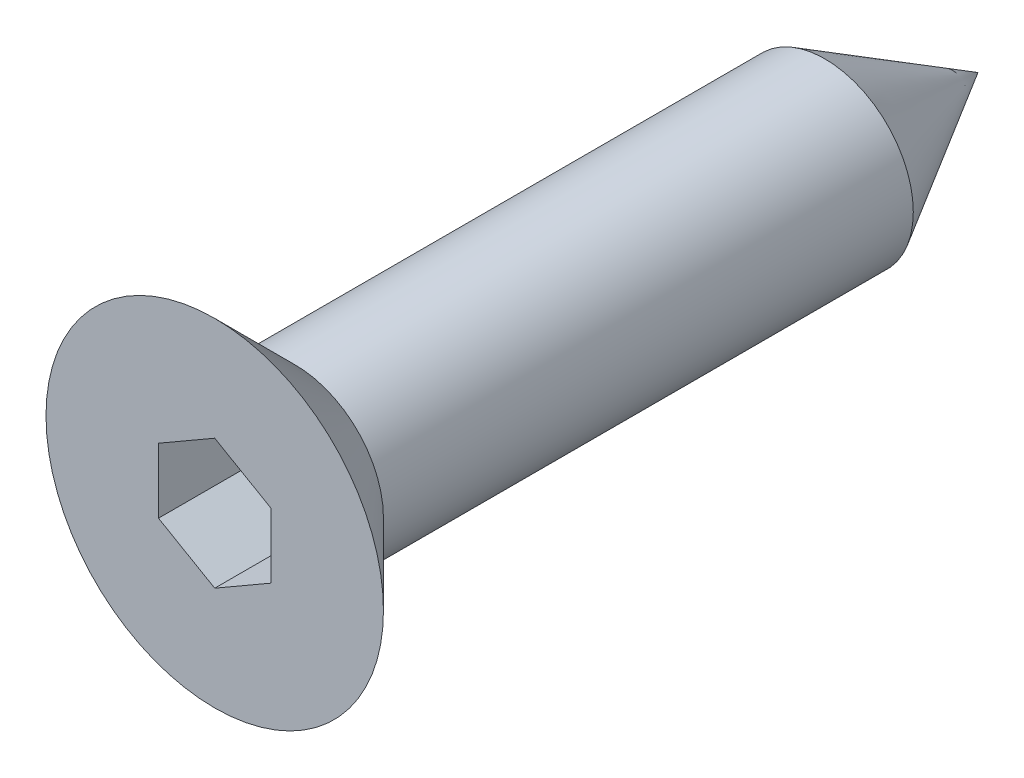
from build123d import *

# Parameters (mm, degrees)
ESQUISSE3_R             = 1.1
EXTRUSION1_DEPTH        = 9.5
ENL_V_MAT_EXTRU_2_DEPTH = 1.5
CHANFREIN1_SIZE         = 1.1
CHANFREIN1_SIZE2        = 1.905255888


with BuildPart() as part:
    # Esquisse1 → Révolution2 (revolve)
    with BuildSketch(Plane(origin=(0, 0, 0), x_dir=(0, 0, -1), z_dir=(1, 0, 0)), mode=Mode.PRIVATE) as r_volution2_sk:
        Polygon((0, 2.1), (1, 1.1), (1, 0), (0, 0), align=None)
    revolve(r_volution2_sk.sketch.rotate(Axis((0, 0, 1.603508429), (0, 0, -1)), 90), axis=Axis((0, 0, 1.603508429), (0, 0, -1)))

    # Esquisse3 → Extrusion1 (add)
    with BuildSketch(Plane.XY):
        Circle(ESQUISSE3_R)
    extrude(amount=-EXTRUSION1_DEPTH)

    # Esquisse2 → Enlèv. mat.-Extru.2 (cut)
    with BuildSketch(Plane.XY):
        Polygon((0, 0.808290377), (-0.7, 0.404145188), (-0.7, -0.404145188), (0, -0.808290377), (0.7, -0.404145188), (0.7, 0.404145188), align=None)
    extrude(amount=-ENL_V_MAT_EXTRU_2_DEPTH, mode=Mode.SUBTRACT)

    # Chanfrein1
    chanfrein1_edges = [part.edges().sort_by_distance(p)[0] for p in [
        (-1.1, 0, -9.5),
    ]]
    chanfrein1_side = [part.faces().sort_by_distance(p)[0] for p in [
        (0, 0, -9.5),
    ]]
    chamfer(chanfrein1_edges, length=CHANFREIN1_SIZE, length2=CHANFREIN1_SIZE2, reference=chanfrein1_side[0])


solid = part.part
